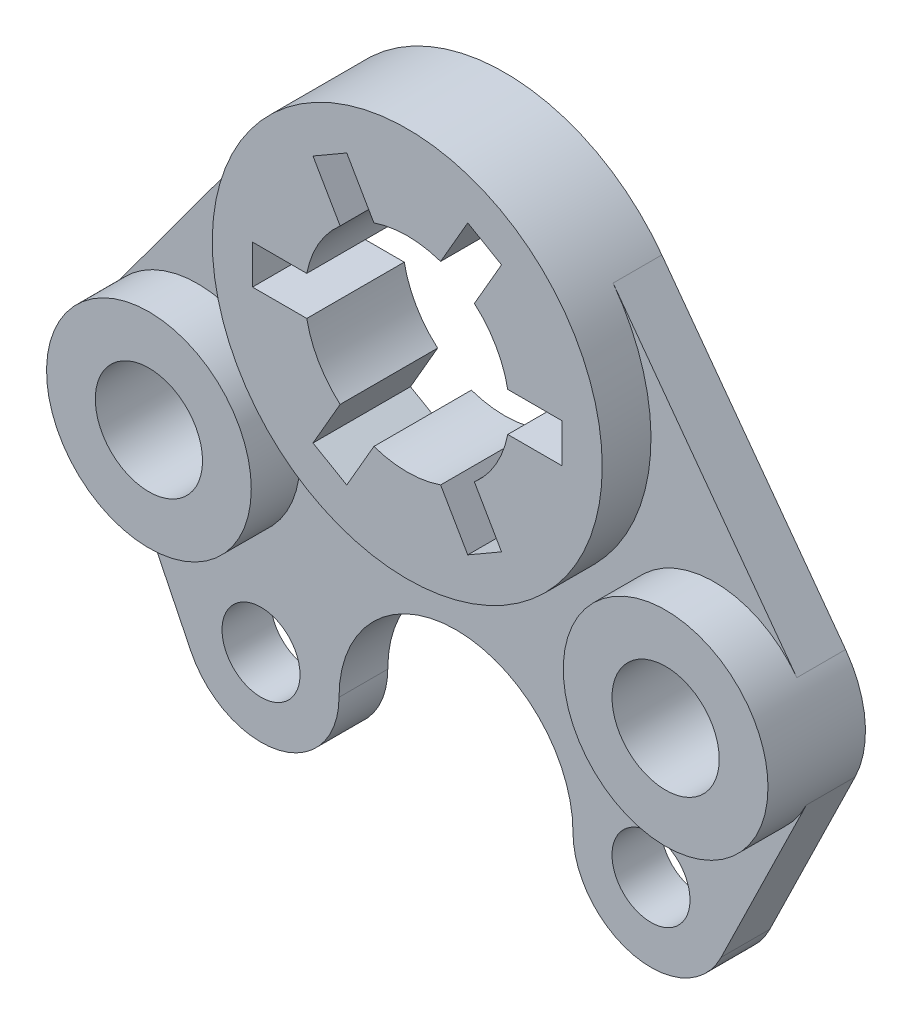
from build123d import *

# Parameters (mm, degrees)
CROQUIS1_R              = 8
SALIENTE_EXTRUIR1_DEPTH = 10
SALIENTE_EXTRUIR2_DEPTH = 10
CROQUIS3_R              = 11
CORTAR_EXTRUIR1_DEPTH   = 122.2930336


with BuildPart() as part:
    # Croquis1 → Saliente-Extruir1 (new body)
    with BuildSketch(Plane.XY):
        with BuildLine():
            Line((-32.224593289, 23.697586108), (-69.917911477, -27.558767293))
            ThreePointArc((-69.917911477, -27.558767293), (-73.915346544, -38.116312412), (-71.868614208, -49.218210124))
            Line((-71.868614208, -49.218210124), (-54.376087015, -85.023398189))
            ThreePointArc((-54.376087015, -85.023398189), (-36.395654862, -93.588736194), (-24, -78))
            ThreePointArc((-24, -78), (0, -54), (24, -78))
            ThreePointArc((24, -78), (36.395654862, -93.588736194), (54.376087015, -85.023398189))
            Line((54.376087015, -85.023398189), (71.868614208, -49.218210124))
            ThreePointArc((71.868614208, -49.218210124), (73.915346544, -38.116312412), (69.917911477, -27.558767293))
            Line((69.917911477, -27.558767293), (32.224593289, 23.697586108))
            ThreePointArc((32.224593289, 23.697586108), (0, 40), (-32.224593289, 23.697586108))
        make_face()
        with Locations((-40, -78)):
            Circle(CROQUIS1_R, mode=Mode.SUBTRACT)
        with Locations((40, -78)):
            Circle(CROQUIS1_R, mode=Mode.SUBTRACT)
    extrude(amount=SALIENTE_EXTRUIR1_DEPTH)

    # Croquis2 → Saliente-Extruir2 (add)
    with BuildSketch(Plane.XY.offset(10)):
        with BuildLine():
            ThreePointArc((32.224593289, 23.697586108), (0, 40), (-32.224593289, 23.697586108))
            ThreePointArc((-32.224593289, 23.697586108), (-12.470290061, -38.006471367), (40, 0))
            ThreePointArc((40, 0), (38.006471367, 12.470290061), (32.224593289, 23.697586108))
        make_face()
        with BuildLine():
            ThreePointArc((-32, -40), (-46.453097718, -20.046602532), (-69.917911477, -27.558767293))
            ThreePointArc((-69.917911477, -27.558767293), (-73.915346544, -38.116312412), (-71.868614208, -49.218210124))
            ThreePointArc((-71.868614208, -49.218210124), (-48.269297006, -60.460216254), (-32, -40))
        make_face()
        with BuildLine():
            ThreePointArc((74, -40), (72.953397468, -33.453097718), (69.917911477, -27.558767293))
            ThreePointArc((69.917911477, -27.558767293), (32.084653456, -41.883687588), (71.868614208, -49.218210124))
            ThreePointArc((71.868614208, -49.218210124), (73.460216254, -44.730702994), (74, -40))
        make_face()
    extrude(amount=SALIENTE_EXTRUIR2_DEPTH)

    # Croquis3 → Cortar-Extruir1 (cut, through all)
    with BuildSketch(Plane.XY.offset(20)):
        with BuildLine():
            Line((-12.410406251, -29.49545417), (-6.843662449, -19.853571071))
            ThreePointArc((-6.843662449, -19.853571071), (0, -21), (6.843662449, -19.853571071))
            Line((6.843662449, -19.853571071), (12.410406251, -29.49545417))
            Line((12.410406251, -29.49545417), (19.338609482, -25.49545417))
            Line((19.338609482, -25.49545417), (13.771865679, -15.853571071))
            ThreePointArc((13.771865679, -15.853571071), (18.186533479, -10.5), (20.615528128, -4))
            Line((20.615528128, -4), (31.749015733, -4))
            Line((31.749015733, -4), (31.749015733, 4))
            Line((31.749015733, 4), (20.615528128, 4))
            ThreePointArc((20.615528128, 4), (18.186533479, 10.5), (13.771865679, 15.853571071))
            Line((13.771865679, 15.853571071), (19.338609482, 25.49545417))
            Line((19.338609482, 25.49545417), (12.410406251, 29.49545417))
            Line((12.410406251, 29.49545417), (6.843662449, 19.853571071))
            ThreePointArc((6.843662449, 19.853571071), (0, 21), (-6.843662449, 19.853571071))
            Line((-6.843662449, 19.853571071), (-12.410406251, 29.49545417))
            Line((-12.410406251, 29.49545417), (-19.338609482, 25.49545417))
            Line((-19.338609482, 25.49545417), (-13.771865679, 15.853571071))
            ThreePointArc((-13.771865679, 15.853571071), (-18.186533479, 10.5), (-20.615528128, 4))
            Line((-20.615528128, 4), (-31.749015733, 4))
            Line((-31.749015733, 4), (-31.749015733, -4))
            Line((-31.749015733, -4), (-20.615528128, -4))
            ThreePointArc((-20.615528128, -4), (-18.186533479, -10.5), (-13.771865679, -15.853571071))
            Line((-13.771865679, -15.853571071), (-19.338609482, -25.49545417))
            Line((-19.338609482, -25.49545417), (-12.410406251, -29.49545417))
        make_face()
        with Locations((53, -40)):
            Circle(CROQUIS3_R)
        with Locations((-53, -40)):
            Circle(CROQUIS3_R)
    extrude(amount=-CORTAR_EXTRUIR1_DEPTH, mode=Mode.SUBTRACT)


solid = part.part
